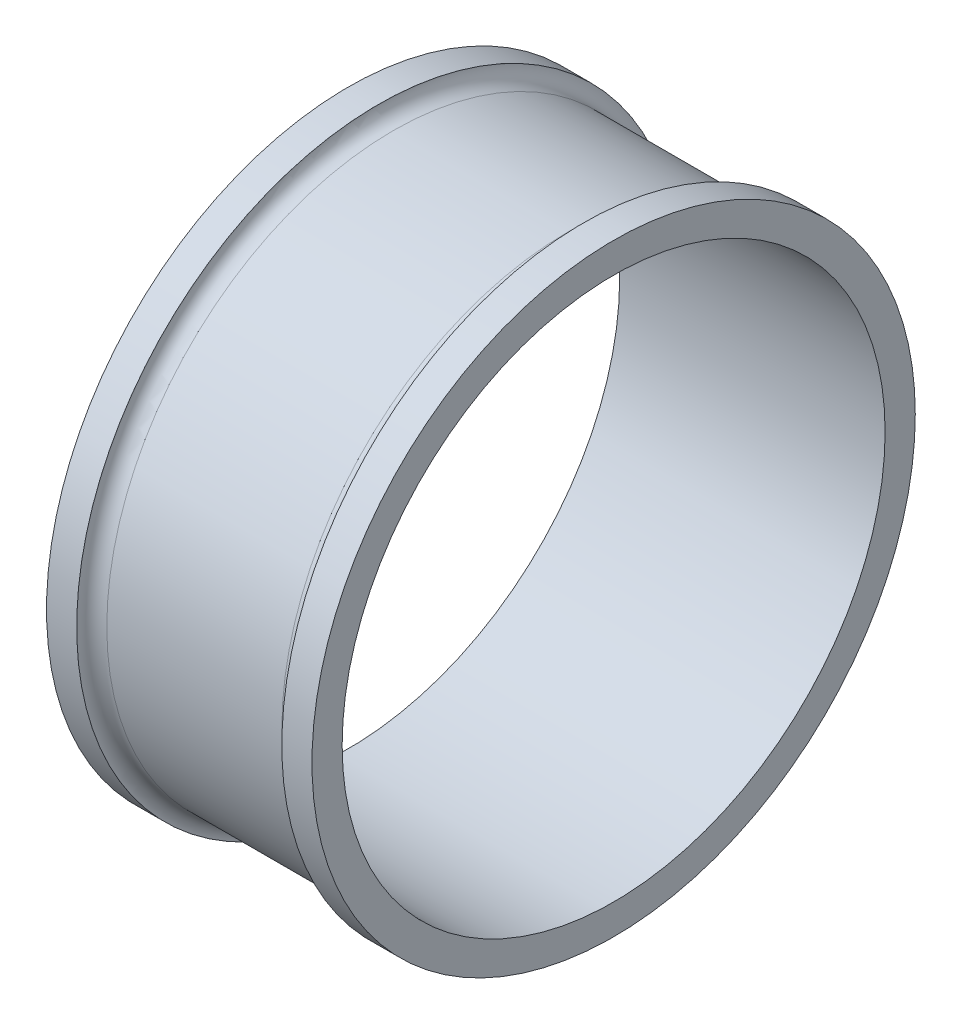
from build123d import *


with BuildPart() as part:
    # Sketch1 → Revolve1 (revolve)
    with BuildSketch(Plane.XY, mode=Mode.PRIVATE) as revolve1_sk:
        with BuildLine():
            Line((22, 45), (-22, 45))
            Line((-22, 45), (-22, 50))
            Line((-22, 50), (-17, 50))
            Line((-17, 50), (-17, 49.99))
            ThreePointArc((-17, 49.99), (-16.270695885, 48.229304115), (-14.51, 47.5))
            Line((-14.51, 47.5), (14.51, 47.5))
            ThreePointArc((14.51, 47.5), (16.270695885, 48.229304115), (17, 49.99))
            Line((17, 49.99), (17, 50))
            Line((17, 50), (22, 50))
            Line((22, 50), (22, 45))
        make_face()
    revolve(revolve1_sk.sketch.rotate(Axis((62.978723404, 0, 0), (-1, 0, 0)), 90), axis=Axis((62.978723404, 0, 0), (-1, 0, 0)))


solid = part.part
